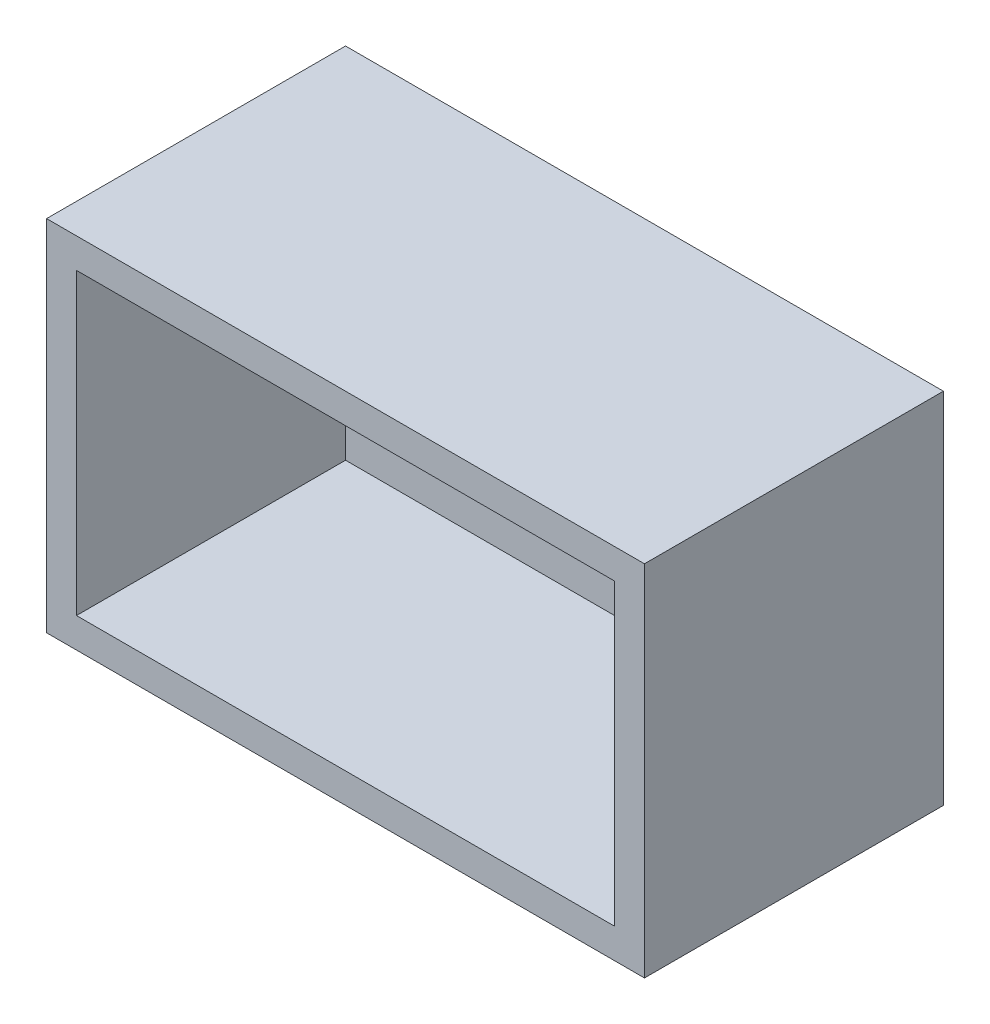
from build123d import *

# Parameters (mm, degrees)
SKETCH_1_W      = 100
SKETCH_1_H      = 60
EXTRUDE_1_DEPTH = 50
SHELL_1_T       = -5


with BuildPart() as part:
    # 草图1 → 凸台-拉伸1 (new body)
    with BuildSketch(Plane.XY):
        Rectangle(SKETCH_1_W, SKETCH_1_H)
    extrude(amount=EXTRUDE_1_DEPTH)

    # 抽壳1
    shell_1_openings = [part.faces().sort_by_distance(p)[0] for p in [
        (0, 0, 50),
    ]]
    offset(amount=SHELL_1_T, openings=shell_1_openings, kind=Kind.INTERSECTION)


solid = part.part
